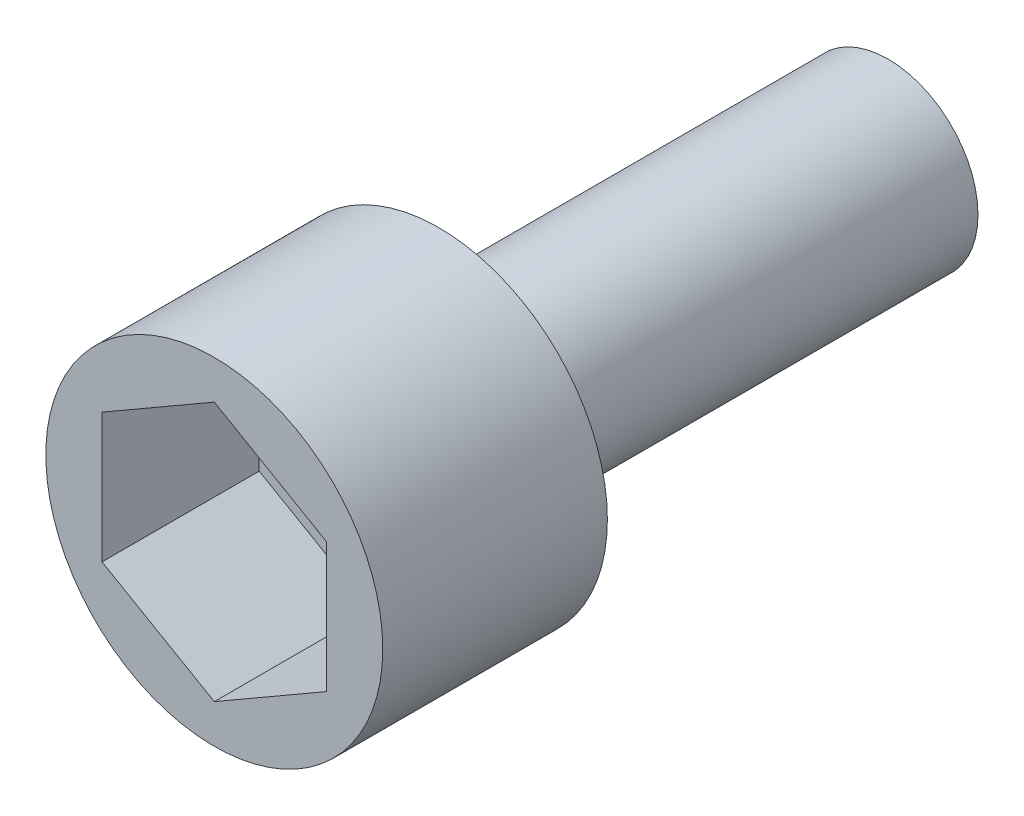
from build123d import *

# Parameters (mm, degrees)
SKETCH1_R           = 7.5
BOSS_EXTRUDE1_DEPTH = 10
SKETCH1_3_R         = 4
BOSS_EXTRUDE2_DEPTH = 30
CUT_EXTRUDE1_DEPTH  = 7


with BuildPart() as part:
    # Sketch1 → Boss-Extrude1 (new body)
    with BuildSketch(Plane.XY):
        Circle(SKETCH1_R)
    extrude(amount=-BOSS_EXTRUDE1_DEPTH)

    # Sketch1<3> → Boss-Extrude2 (add)
    with BuildSketch(Plane.XY):
        Circle(SKETCH1_3_R)
    extrude(amount=-BOSS_EXTRUDE2_DEPTH)

    # Sketch1<4> → Cut-Extrude1 (cut)
    with BuildSketch(Plane.XY):
        Polygon((0, 5.773502692), (-5, 2.886751346), (-5, -2.886751346), (0, -5.773502692), (5, -2.886751346), (5, 2.886751346), align=None)
    extrude(amount=-CUT_EXTRUDE1_DEPTH, mode=Mode.SUBTRACT)


solid = part.part
